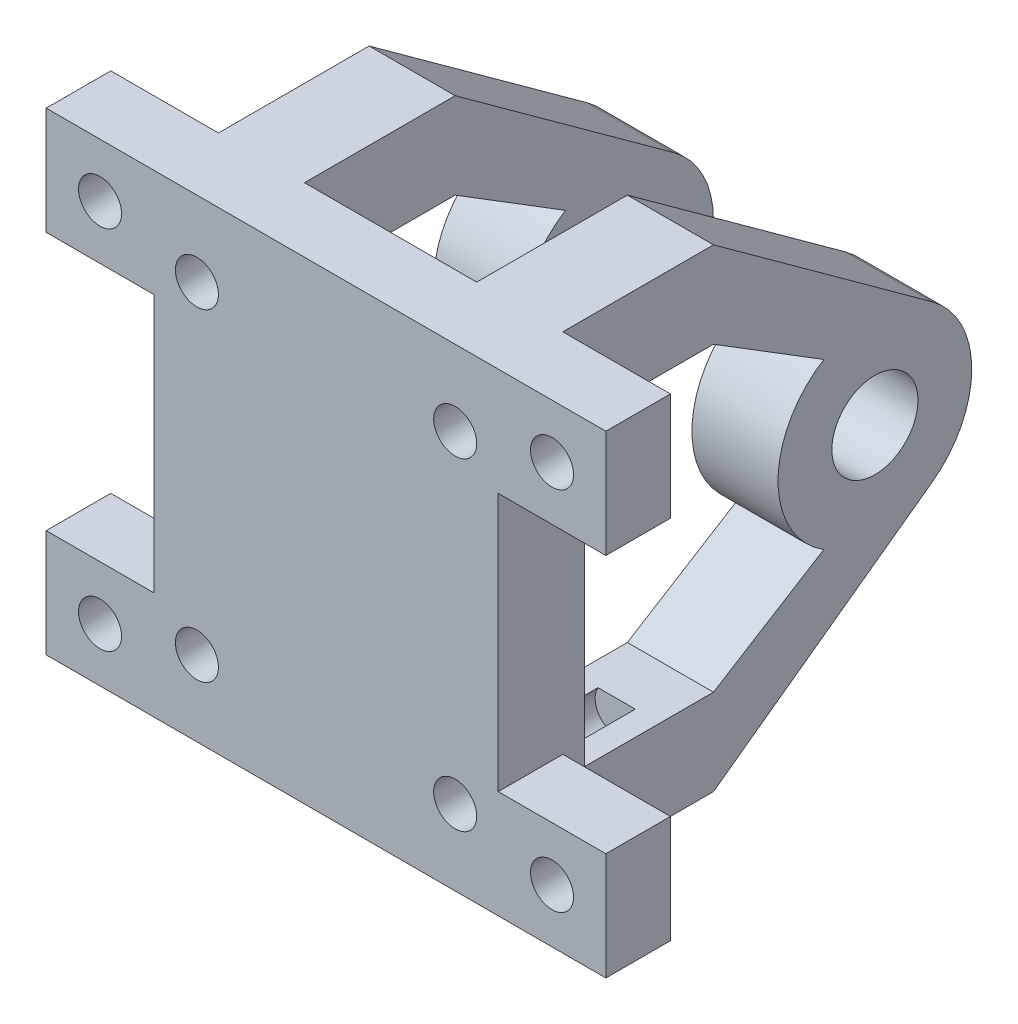
from build123d import *

# Parameters (mm, degrees)
SKETCH_1_R          = 4
EXTRUDE_1_DEPTH     = 4
SKETCH_2_R          = 2
CUT_EXTRUDE_1_DEPTH = 15
SKETCH_4_W          = 16
SKETCH_4_H          = 44
EXTRUDE_2_DEPTH     = 6
SKETCH_5_W          = 10
SKETCH_5_H          = 10
SKETCH_5_R          = 2
EXTRUDE_3_DEPTH     = 6
SKETCH_6_R          = 1.5
CUT_EXTRUDE_2_DEPTH = 54.749418602


with BuildPart() as part:
    # 草图1 → 凸台-拉伸1 (new, symmetric)
    with BuildSketch(Plane(origin=(0, 0, 0), x_dir=(0, 0, -1), z_dir=(1, 0, 0))):
        with BuildLine():
            Line((5.28471901, 7.285035689), (-15, 22))
            Line((-15, 22), (-35, 22))
            Line((-35, 22), (-35, -0.025536126))
            Line((-35, -0.025536126), (-35, -22))
            Line((-35, -22), (-15, -22))
            Line((-15, -22), (5.28471901, -7.285035689))
            ThreePointArc((5.28471901, -7.285035689), (9, 0), (5.28471901, 7.285035689))
        make_face()
        Circle(SKETCH_1_R, mode=Mode.SUBTRACT)
        with BuildLine():
            Line((-4.746449606, 7.646647379), (-15, 14))
            Line((-15, 14), (-27, 14))
            Line((-27, 14), (-27, -14))
            Line((-27, -14), (-15, -14))
            Line((-15, -14), (-4.746449606, -7.646647379))
            ThreePointArc((-4.746449606, -7.646647379), (-9, 0), (-4.746449606, 7.646647379))
        make_face(mode=Mode.SUBTRACT)
    extrude_1 = extrude(amount=EXTRUDE_1_DEPTH, both=True)

    # 草图2 → 切除-拉伸1 (cut)
    with BuildSketch(Plane.XY.offset(35)):
        with Locations((0, 15)):
            Circle(SKETCH_2_R)
        with Locations(Location((0, -15, 0), (0, 0, 30))):
            Circle(SKETCH_2_R)
    cut_extrude_1 = extrude(amount=-CUT_EXTRUDE_1_DEPTH, mode=Mode.SUBTRACT)

    # 草图4 → 凸台-拉伸2 (add)
    with BuildSketch(Plane.XY.offset(35)):
        with Locations((12, 0)):
            Rectangle(SKETCH_4_W, SKETCH_4_H)
    extrude(amount=-EXTRUDE_2_DEPTH)

    # 镜向1: 凸台-拉伸1, 切除-拉伸1 across plane
    add(extrude_1.mirror(Plane(origin=(12, 0, 0), x_dir=(0, 0, 1), z_dir=(1, 0, 0))))
    add(cut_extrude_1.mirror(Plane(origin=(12, 0, 0), x_dir=(0, 0, 1), z_dir=(1, 0, 0))), mode=Mode.SUBTRACT)

    # 草图5 → 凸台-拉伸3 (add)
    # profile 1 of 4: a face of its own
    with BuildSketch(Plane.XY.offset(35)):
        with Locations((-9, 17)):
            Rectangle(SKETCH_5_W, SKETCH_5_H)
        with Locations((-9, 17)):
            Circle(SKETCH_5_R, mode=Mode.SUBTRACT)
    # profile 2 of 4: a face of its own
    with BuildSketch(Plane.XY.offset(35)):
        with Locations((33, 17)):
            Rectangle(SKETCH_5_W, SKETCH_5_H)
        with Locations(Location((33, 17, 0), (0, 0, 180))):
            Circle(SKETCH_5_R, mode=Mode.SUBTRACT)
    # profile 3 of 4: a face of its own
    with BuildSketch(Plane.XY.offset(35)):
        with Locations((33, -17)):
            Rectangle(SKETCH_5_W, SKETCH_5_H)
        with Locations((33, -17)):
            Circle(SKETCH_5_R, mode=Mode.SUBTRACT)
    # profile 4 of 4: a face of its own
    with BuildSketch(Plane.XY.offset(35)):
        with Locations((-9, -17)):
            Rectangle(SKETCH_5_W, SKETCH_5_H)
        with Locations(Location((-9, -17, 0), (0, 0, 180))):
            Circle(SKETCH_5_R, mode=Mode.SUBTRACT)
    extrude(amount=-EXTRUDE_3_DEPTH)

    # 草图6 → 切除-拉伸2 (cut, through all)
    with BuildSketch(Plane(origin=(0, 0, 4), x_dir=(-1, 0, 0), z_dir=(0, 0, -1))):
        Circle(SKETCH_6_R)
    extrude(amount=CUT_EXTRUDE_2_DEPTH, mode=Mode.SUBTRACT)


solid = part.part
